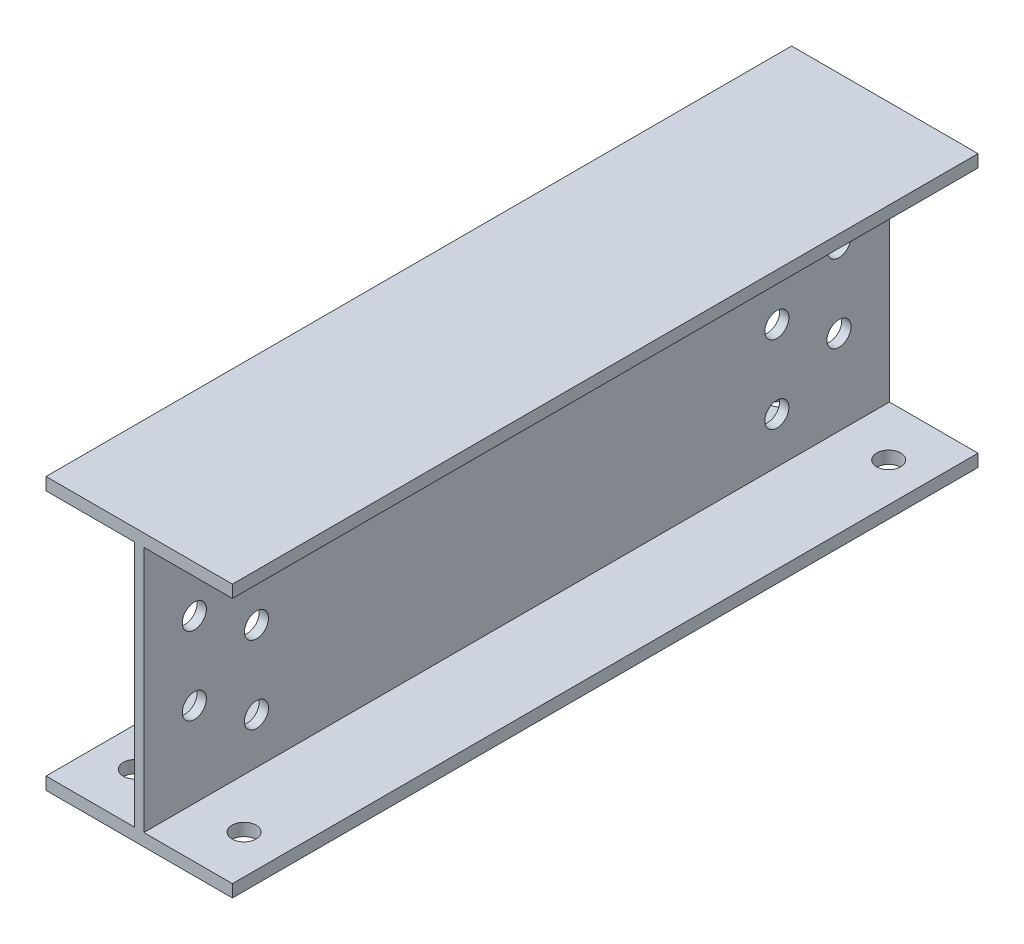
from build123d import *

# Parameters (mm, degrees)
EXTRUDE_1_DEPTH          = 480
CUT_EXTRUDE_2_DEPTH      = 525.809489243
CUT_EXTRUDE_2_DEPTH_BACK = 525.809489243
SKETCH_2_R               = 15.5
SKETCH_5_R               = 15.5
CUT_EXTRUDE_4_DEPTH      = 597.95560974


with BuildPart() as part:
    # 草图1 → 拉伸1 (new, symmetric)
    with BuildSketch(Plane.XY):
        Polygon((-6, 159), (-120, 159), (-120, 175), (120, 175), (120, 159), (6, 159), (6, -159), (120, -159), (120, -175), (-120, -175), (-120, -159), (-6, -159), align=None)
    extrude(amount=EXTRUDE_1_DEPTH, both=True)

    # 草图2 → 拉伸2 (cut, two sides: drawn at the far end of the back side and taken through both)
    with BuildSketch(Plane(origin=(0, 0, 0), x_dir=(0, 0, -1), z_dir=(1, 0, 0)).offset(-CUT_EXTRUDE_2_DEPTH_BACK)):
        with Locations(Location((-415, 50, 0), (0, 0, 270))):
            Circle(SKETCH_2_R)
        with Locations(Location((-334.999961203, 100, 0), (0, 0, 270))):
            Circle(SKETCH_2_R)
        with Locations(Location((-334.999961203, 0, 0), (0, 0, 270))):
            Circle(SKETCH_2_R)
        with Locations(Location((-334.999961203, -100, 0), (0, 0, 270))):
            Circle(SKETCH_2_R)
        with Locations(Location((-415, -50, 0), (0, 0, 270))):
            Circle(SKETCH_2_R)
        with Locations(Location((415, -50, 0), (0, 0, 270))):
            Circle(SKETCH_2_R)
        with Locations(Location((334.999961203, -100, 0), (0, 0, 270))):
            Circle(SKETCH_2_R)
        with Locations(Location((334.999961203, 0, 0), (0, 0, 270))):
            Circle(SKETCH_2_R)
        with Locations(Location((334.999961203, 100, 0), (0, 0, 270))):
            Circle(SKETCH_2_R)
        with Locations(Location((415, 50, 0), (0, 0, 270))):
            Circle(SKETCH_2_R)
    extrude(amount=CUT_EXTRUDE_2_DEPTH + CUT_EXTRUDE_2_DEPTH_BACK, mode=Mode.SUBTRACT)

    # 草图5 → 拉伸4 (cut, through all)
    with BuildSketch(Plane(origin=(0, -159, 0), x_dir=(1, 0, 0), z_dir=(0, 1, 0))):
        with Locations(Location((-70, 415, 0), (0, 0, 270))):
            Circle(SKETCH_5_R)
        with Locations(Location((70, 415, 0), (0, 0, 270))):
            Circle(SKETCH_5_R)
        with Locations(Location((-70, -415, 0), (0, 0, 90))):
            Circle(SKETCH_5_R)
        with Locations(Location((70, -415, 0), (0, 0, 90))):
            Circle(SKETCH_5_R)
    extrude(amount=-CUT_EXTRUDE_4_DEPTH, mode=Mode.SUBTRACT)


solid = part.part
